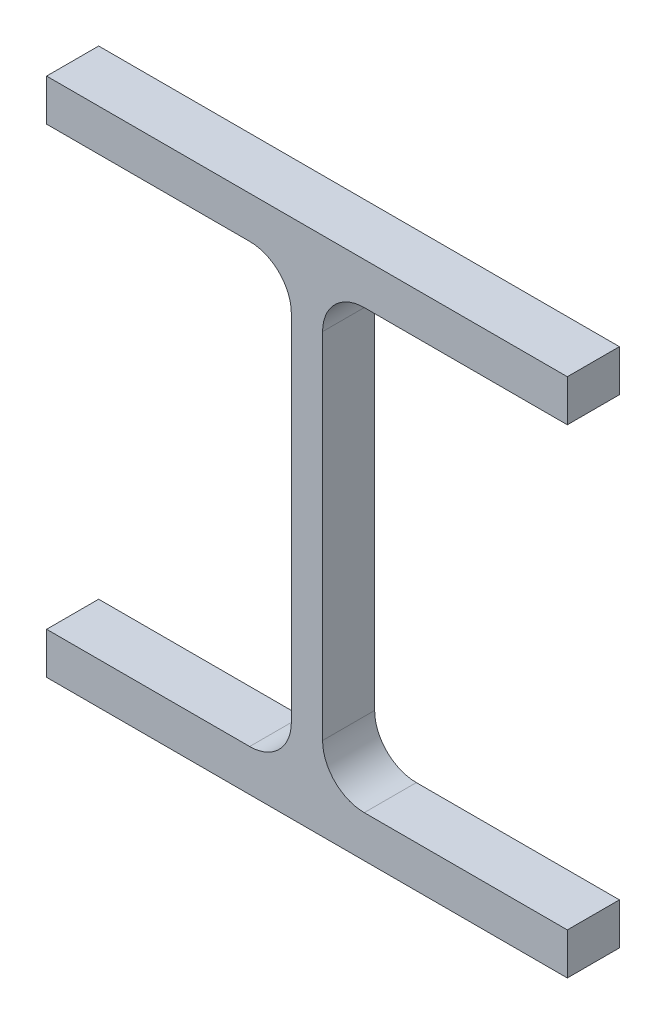
from build123d import *

# Parameters (mm, degrees)
EXTRUDE_1_DEPTH = 10
FILLET_1_R      = 8


with BuildPart() as part:
    # 草图1 → 凸台-拉伸1 (new body)
    with BuildSketch(Plane.XY):
        Polygon((50, 50), (-50, 50), (-50, 42), (-3, 42), (-3, -42), (-50, -42), (-50, -50), (50, -50), (50, -42), (3, -42), (3, 42), (50, 42), align=None)
    extrude(amount=EXTRUDE_1_DEPTH)

    # 圆角1
    fillet_1_edges = [part.edges().sort_by_distance(p)[0] for p in [
        (-3, -42, 5),
        (-3, 42, 5),
        (3, 42, 5),
        (3, -42, 5),
    ]]
    fillet(fillet_1_edges, radius=FILLET_1_R)


solid = part.part
